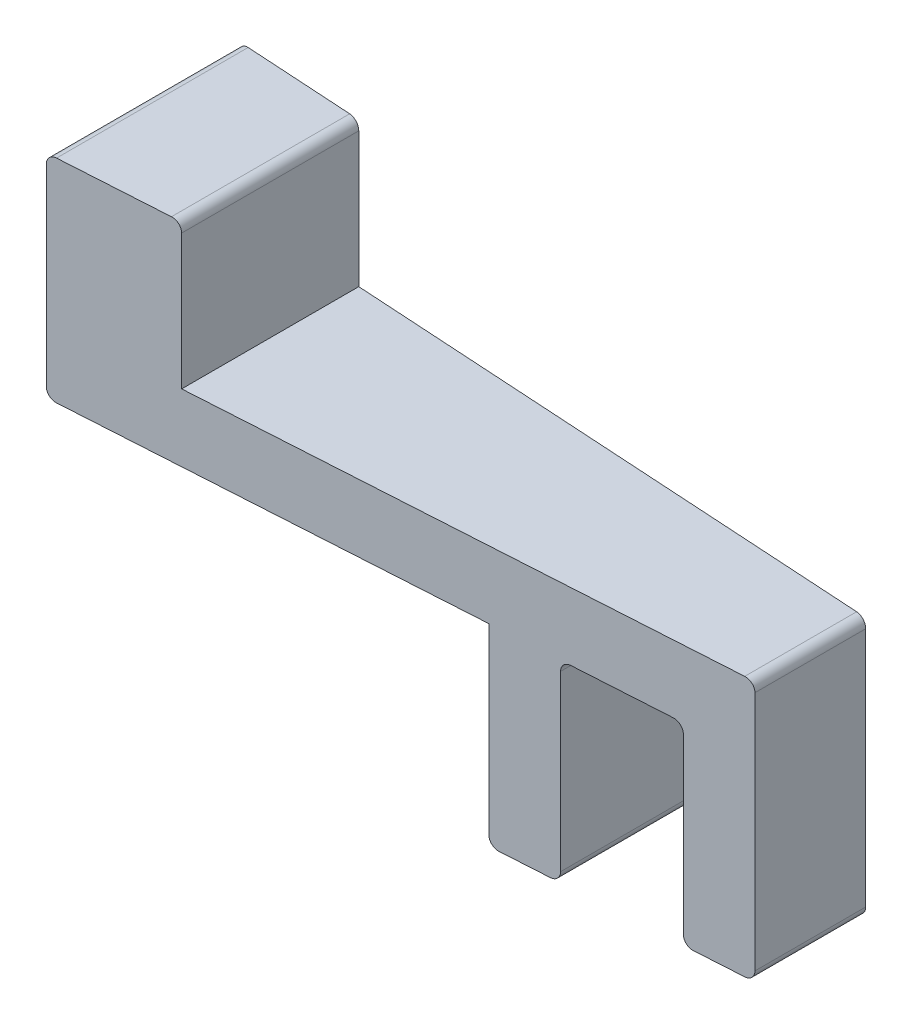
from build123d import *

# Parameters (mm, degrees)
EXTRUDE_1_DEPTH     = 20
CUT_EXTRUDE_1_DEPTH = 82


with BuildPart() as part:
    # Эскиз1 → Бобышка-Вытянуть1 (new body)
    with BuildSketch(Plane.XY):
        with BuildLine():
            Line((0, 1), (0, 21))
            ThreePointArc((0, 21), (0.292893219, 21.707106781), (1, 22))
            Line((1, 22), (12.229943888, 22))
            ThreePointArc((12.229943888, 22), (12.937050669, 21.707106781), (13.229943888, 21))
            Line((13.229943888, 21), (13.229943888, 7))
            Line((13.229943888, 7), (41.229943888, 7))
            Line((41.229943888, 7), (68.26571085, 7))
            ThreePointArc((68.26571085, 7), (68.972817632, 6.707106781), (69.26571085, 6))
            Line((69.26571085, 6), (69.26571085, -19))
            ThreePointArc((69.26571085, -19), (68.972817632, -19.707106781), (68.26571085, -20))
            Line((68.26571085, -20), (63.26571085, -20))
            ThreePointArc((63.26571085, -20), (62.558604069, -19.707106781), (62.26571085, -19))
            Line((62.26571085, -19), (62.26571085, -1))
            ThreePointArc((62.26571085, -1), (61.972817632, -0.292893219), (61.26571085, 0))
            Line((61.26571085, 0), (51.26571085, 0))
            ThreePointArc((51.26571085, 0), (50.558604069, -0.292893219), (50.26571085, -1))
            Line((50.26571085, -1), (50.26571085, -19))
            ThreePointArc((50.26571085, -19), (49.972817632, -19.707106781), (49.26571085, -20))
            Line((49.26571085, -20), (44.26571085, -20))
            ThreePointArc((44.26571085, -20), (43.558604069, -19.707106781), (43.26571085, -19))
            Line((43.26571085, -19), (43.26571085, 0))
            Line((43.26571085, 0), (1, 0))
            ThreePointArc((1, 0), (0.292893219, 0.292893219), (0, 1))
        make_face()
    extrude(amount=EXTRUDE_1_DEPTH)

    # Эскиз2 → Вырез-Вытянуть1 (cut)
    with BuildSketch(Plane(origin=(0, 22, 0), x_dir=(1, 0, 0), z_dir=(0, 1, 0))):
        Polygon((81.392917707, -5), (0, 0), (88.471949447, 13.866629824), align=None)
        Polygon((81.392917707, -15), (0, -20), (97.493424041, -39.682856986), align=None)
    extrude(amount=-CUT_EXTRUDE_1_DEPTH, mode=Mode.SUBTRACT)


solid = part.part
